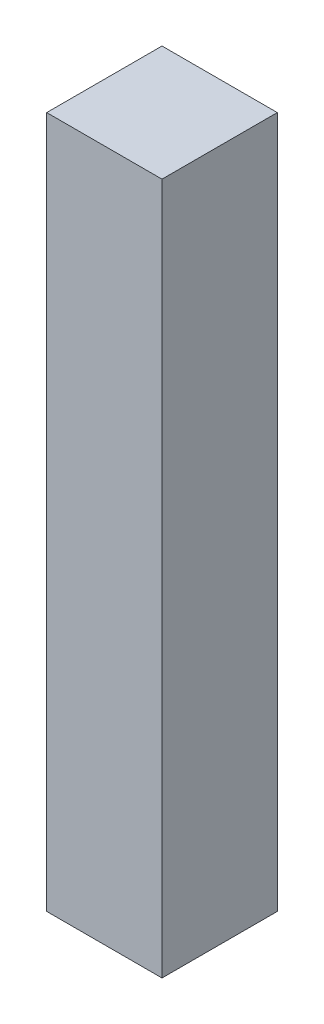
from build123d import *

# Parameters (mm, degrees)
SKETCH1_W           = 12.7
SKETCH1_H           = 12.7
BOSS_EXTRUDE1_DEPTH = 76.2


with BuildPart() as part:
    # Sketch1 → Boss-Extrude1 (new body)
    with BuildSketch(Plane(origin=(0, 0, 0), x_dir=(1, 0, 0), z_dir=(0, 1, 0))):
        Rectangle(SKETCH1_W, SKETCH1_H)
    extrude(amount=BOSS_EXTRUDE1_DEPTH)


solid = part.part
